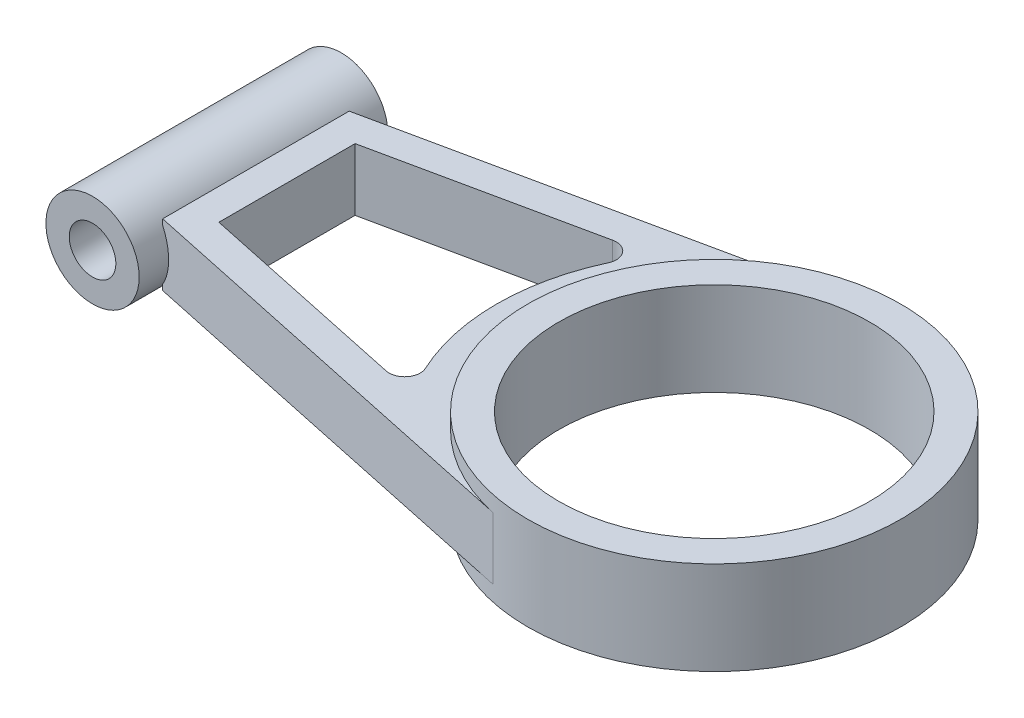
from build123d import *

# Parameters (mm, degrees)
CROQUIS2_R              = 50
SALIENTE_EXTRUIR3_DEPTH = 30
CORTAR_EXTRUIR1_DEPTH   = 5
CORTAR_EXTRUIR2_START   = -5
CORTAR_EXTRUIR2_DEPTH   = 5
CROQUIS7_R              = 15
SALIENTE_EXTRUIR4_DEPTH = 40
SALIENTE_EXTRUIR5_START = -40
CROQUIS7_2_R            = 15
SALIENTE_EXTRUIR5_DEPTH = 40
CROQUIS8_R              = 7.5
CORTAR_EXTRUIR3_DEPTH   = 204.776838723


with BuildPart() as part:
    # Croquis2 → Saliente-Extruir3 (new body)
    with BuildSketch(Plane(origin=(0, 0, 0), x_dir=(1, 0, 0), z_dir=(0, 1, 0))):
        with BuildLine():
            Line((-147.4451574, 30), (-12.474701449, 58.688856044))
            ThreePointArc((-12.474701449, 58.688856044), (60, 0), (-12.474701449, -58.688856044))
            Line((-12.474701449, -58.688856044), (-147.4451574, -30))
            Line((-147.4451574, -30), (-147.4451574, 30))
        make_face()
        Circle(CROQUIS2_R, mode=Mode.SUBTRACT)
        with BuildLine():
            Line((-137.4451574, -21.902159668), (-69.084440585, -36.432678588))
            ThreePointArc((-69.084440585, -36.432678588), (-64.13537775, -34.658954459), (-63.508556655, -29.439144545))
            ThreePointArc((-63.508556655, -29.439144545), (-70, 0), (-63.508556655, 29.439144545))
            ThreePointArc((-63.508556655, 29.439144545), (-64.13537775, 34.658954459), (-69.084440585, 36.432678588))
            Line((-69.084440585, 36.432678588), (-137.4451574, 21.902159668))
            Line((-137.4451574, 21.902159668), (-137.4451574, -21.902159668))
        make_face(mode=Mode.SUBTRACT)
    extrude(amount=SALIENTE_EXTRUIR3_DEPTH)

    # Croquis4 → Cortar-Extruir1 (cut)
    with BuildSketch(Plane(origin=(0, 0, 0), x_dir=(1, 0, 0), z_dir=(0, 1, 0))):
        with BuildLine():
            Line((-147.4451574, -30), (-12.474701449, -58.688856044))
            ThreePointArc((-12.474701449, -58.688856044), (-60, 0), (-12.474701449, 58.688856044))
            Line((-12.474701449, 58.688856044), (-147.4451574, 30))
            Line((-147.4451574, 30), (-147.4451574, -30))
        make_face()
        with BuildLine():
            Line((-69.084440585, 36.432678588), (-137.4451574, 21.902159668))
            Line((-137.4451574, 21.902159668), (-137.4451574, -21.902159668))
            Line((-137.4451574, -21.902159668), (-69.084440585, -36.432678588))
            ThreePointArc((-69.084440585, -36.432678588), (-64.13537775, -34.658954459), (-63.508556655, -29.439144545))
            ThreePointArc((-63.508556655, -29.439144545), (-70, 0), (-63.508556655, 29.439144545))
            ThreePointArc((-63.508556655, 29.439144545), (-64.13537775, 34.658954459), (-69.084440585, 36.432678588))
        make_face(mode=Mode.SUBTRACT)
    extrude(amount=CORTAR_EXTRUIR1_DEPTH, mode=Mode.SUBTRACT)

    # Croquis5 → Cortar-Extruir2 (cut)
    with BuildSketch(Plane(origin=(0, 30, 0), x_dir=(1, 0, 0), z_dir=(0, 1, 0)).offset(CORTAR_EXTRUIR2_START)):
        with BuildLine():
            Line((-147.4451574, 30), (-147.4451574, -30))
            Line((-147.4451574, -30), (-12.474701449, -58.688856044))
            ThreePointArc((-12.474701449, -58.688856044), (-60, 0), (-12.474701449, 58.688856044))
            Line((-12.474701449, 58.688856044), (-147.4451574, 30))
        make_face()
        with BuildLine():
            Line((-137.4451574, -21.902159668), (-69.084440585, -36.432678588))
            ThreePointArc((-69.084440585, -36.432678588), (-64.13537775, -34.658954459), (-63.508556655, -29.439144545))
            ThreePointArc((-63.508556655, -29.439144545), (-70, 0), (-63.508556655, 29.439144545))
            ThreePointArc((-63.508556655, 29.439144545), (-64.13537775, 34.658954459), (-69.084440585, 36.432678588))
            Line((-69.084440585, 36.432678588), (-137.4451574, 21.902159668))
            Line((-137.4451574, 21.902159668), (-137.4451574, -21.902159668))
        make_face(mode=Mode.SUBTRACT)
    extrude(amount=CORTAR_EXTRUIR2_DEPTH, mode=Mode.SUBTRACT)

    # Croquis7 → Saliente-Extruir4 (add)
    with BuildSketch(Plane.XY):
        with Locations((-160, 15)):
            Circle(CROQUIS7_R)
    extrude(amount=SALIENTE_EXTRUIR4_DEPTH)

    # Croquis7<2> → Saliente-Extruir5 (add)
    with BuildSketch(Plane.XY.offset(SALIENTE_EXTRUIR5_START)):
        with Locations((-160, 15)):
            Circle(CROQUIS7_2_R)
    extrude(amount=SALIENTE_EXTRUIR5_DEPTH)

    # Croquis8 → Cortar-Extruir3 (cut, through all)
    with BuildSketch(Plane.XY.offset(40)):
        with Locations((-160, 15)):
            Circle(CROQUIS8_R)
    extrude(amount=-CORTAR_EXTRUIR3_DEPTH, mode=Mode.SUBTRACT)


solid = part.part
